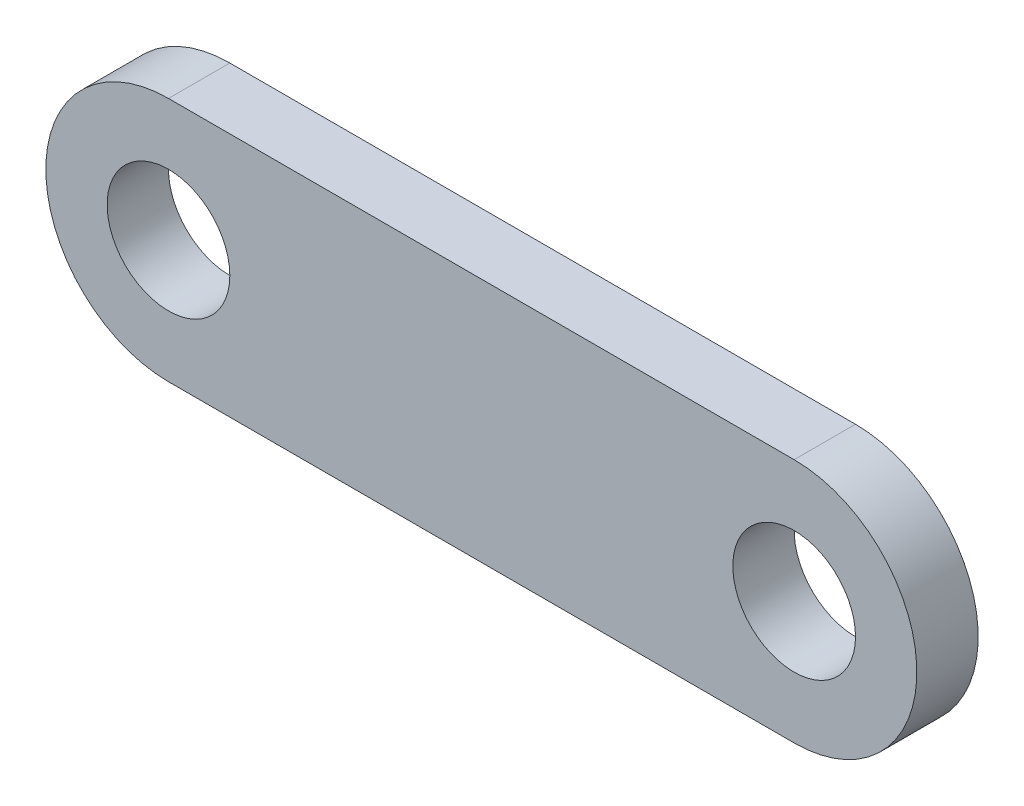
from build123d import *

# Parameters (mm, degrees)
CROQUIS1_R              = 5
SALIENTE_EXTRUIR1_DEPTH = 5


with BuildPart() as part:
    # Croquis1 → Saliente-Extruir1 (new body)
    with BuildSketch(Plane.XY):
        with BuildLine():
            Line((-25.5, 10), (25.5, 10))
            ThreePointArc((25.5, 10), (35.5, 0), (25.5, -10))
            Line((25.5, -10), (-25.5, -10))
            ThreePointArc((-25.5, -10), (-35.5, 0), (-25.5, 10))
        make_face()
        with Locations((25.5, 0)):
            Circle(CROQUIS1_R, mode=Mode.SUBTRACT)
        with Locations((-25.5, 0)):
            Circle(CROQUIS1_R, mode=Mode.SUBTRACT)
    extrude(amount=SALIENTE_EXTRUIR1_DEPTH)


solid = part.part
